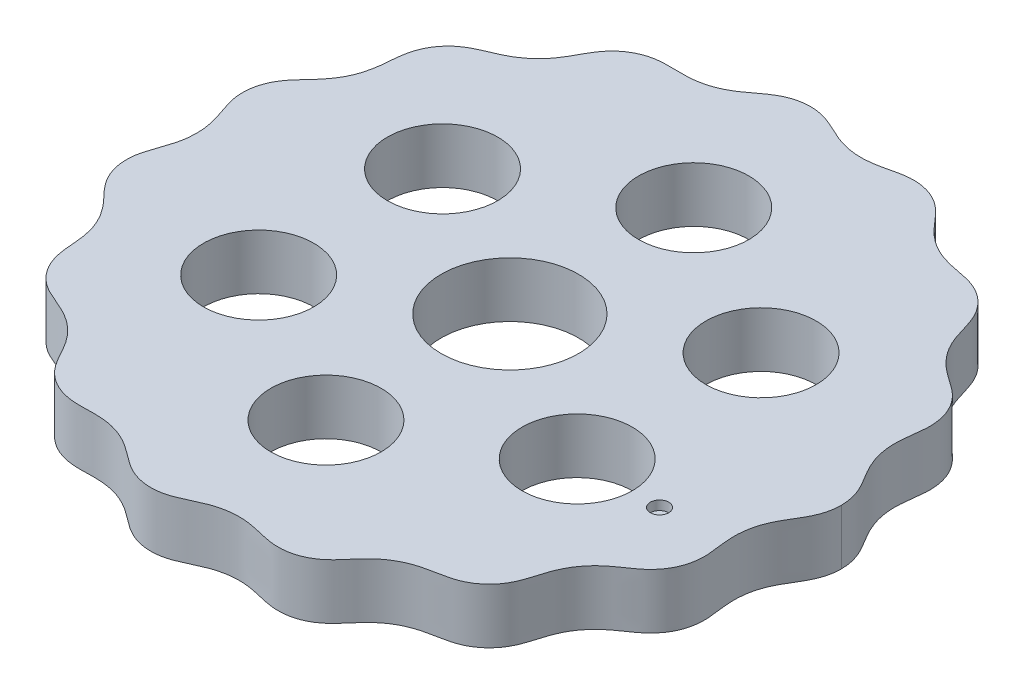
from build123d import *

# Parameters (mm, degrees)
BOSS_EXTRUDE1_DEPTH = 6
SKETCH4_R           = 7.475
SKETCH4_R_2         = 6
CUT_EXTRUDE1_DEPTH  = 52.453967101
SKETCH5_R           = 1
CUT_EXTRUDE2_DEPTH  = 1


with BuildPart() as part:
    # Sketch3 → Boss-Extrude1 (new body)
    with BuildSketch(Plane(origin=(0, 0, 0), x_dir=(1, 0, 0), z_dir=(0, 1, 0))):
        with BuildLine():
            add(Edge.make_bspline(
                [(-35.05, 0), (-35.05, 0.594198712), (-35.191346512, 1.787119828), (-35.774573788, 3.479633265), (-36.370656393, 5.193307382), (-36.439574506, 7.030295887), (-35.925490495, 8.79622364), (-34.876295144, 10.295275654), (-33.585470062, 11.549316205), (-32.487706663, 12.969248766), (-31.742957144, 14.606988848), (-31.396565397, 16.368457148), (-31.326535289, 18.165589032), (-30.95261129, 19.954463161), (-30.017730934, 21.538471981), (-28.632110729, 22.747490259), (-26.968497206, 23.475804895), (-24.757057662, 24.380387794), (-22.911251771, 25.983589547), (-21.734896935, 28.063477736), (-20.879346019, 29.660513957), (-19.589334554, 30.969735845), (-17.95061886, 31.804064637), (-16.138162859, 32.06669982), (-14.340381143, 31.948143856), (-12.549747042, 32.056592443), (-10.825868458, 32.571684344), (-9.270456611, 33.470271575), (-7.887358387, 34.616091716), (-6.327923269, 35.566471435), (-4.533281987, 35.96990507), (-2.70292921, 35.78952335), (-1.035797595, 35.063699847), (0.572152539, 34.273651103), (2.313154203, 33.82213675), (4.112230724, 33.789925988), (5.866279551, 34.152011292), (7.619077132, 34.603765566), (9.455361714, 34.561863227), (11.185634397, 33.938560874), (12.620076924, 32.797434213), (13.740202432, 31.383739916), (15.000377212, 30.10818058), (16.521643713, 29.147509603), (18.222513756, 28.567155407), (19.996356323, 28.29831819), (22.342794246, 27.65042603), (24.201171408, 25.896958922), (25.005623957, 23.605348695), (25.480441092, 21.877479041), (26.284970675, 20.269271474), (27.44342461, 18.892648679), (28.872607627, 17.811880308), (30.387945124, 16.825917609), (31.615542716, 15.461139334), (32.345791834, 13.773450902), (32.497916201, 11.945393512), (32.20498318, 10.163517983), (32.075775497, 8.375827667), (32.351741871, 6.597861172), (33.033589236, 4.934690781), (34.012035472, 3.431229806), (34.855336803, 1.817850793), (35.05, 0.601878761), (35.05, 0)],
                knots=[0.072369566, 0.072369566, 0.072369566, 0.072369566, 0.085664924, 0.098960282, 0.112255641, 0.125550999, 0.138846357, 0.152141715, 0.165437073, 0.178732431, 0.192027789, 0.205323147, 0.218618505, 0.231913863, 0.245209221, 0.25850458, 0.271799938, 0.285095296, 0.311686012, 0.32498137, 0.338276728, 0.351572086, 0.364867444, 0.378162802, 0.39145816, 0.404753519, 0.418048877, 0.431344235, 0.444639593, 0.457934951, 0.471230309, 0.484525667, 0.497821025, 0.511116383, 0.524411741, 0.5377071, 0.551002458, 0.564297816, 0.577593174, 0.590888532, 0.60418389, 0.617479248, 0.630774606, 0.644069964, 0.657365322, 0.67066068, 0.683956039, 0.710546755, 0.723842113, 0.737137471, 0.750432829, 0.763728187, 0.777023545, 0.790318903, 0.803614261, 0.816909619, 0.830204978, 0.843500336, 0.856795694, 0.870091052, 0.88338641, 0.896681768, 0.909977126, 0.923272484, 0.923272484, 0.923272484, 0.923272484], degree=3))
            add(Edge.make_bspline(
                [(35.05, 0), (35.05, -0.601878761), (34.855336803, -1.817850793), (34.012035472, -3.431229806), (33.033589236, -4.934690781), (32.351741871, -6.597861172), (32.075775497, -8.375827667), (32.20498318, -10.163517983), (32.497916201, -11.945393512), (32.345791834, -13.773450902), (31.615542716, -15.461139334), (30.387945124, -16.825917609), (28.872607627, -17.811880308), (27.44342461, -18.892648679), (26.284970675, -20.269271474), (25.480441092, -21.877479041), (25.005623957, -23.605348695), (24.201171408, -25.896958922), (22.342794246, -27.65042603), (19.996356323, -28.29831819), (18.222513756, -28.567155407), (16.521643713, -29.147509603), (15.000377212, -30.10818058), (13.740202432, -31.383739916), (12.620076924, -32.797434213), (11.185634397, -33.938560874), (9.455361714, -34.561863227), (7.619077132, -34.603765566), (5.866279551, -34.152011292), (4.112230724, -33.789925988), (2.313154203, -33.82213675), (0.572152539, -34.273651103), (-1.035797595, -35.063699847), (-2.70292921, -35.78952335), (-4.533281987, -35.96990507), (-6.327923269, -35.566471435), (-7.887358387, -34.616091716), (-9.270456611, -33.470271575), (-10.825868458, -32.571684344), (-12.549747042, -32.056592443), (-14.340381143, -31.948143856), (-16.138162859, -32.06669982), (-17.95061886, -31.804064637), (-19.589334554, -30.969735845), (-20.879346019, -29.660513957), (-21.734896935, -28.063477736), (-22.911251771, -25.983589547), (-24.757057662, -24.380387794), (-26.968497206, -23.475804895), (-28.632110729, -22.747490259), (-30.017730934, -21.538471981), (-30.95261129, -19.954463161), (-31.326535289, -18.165589032), (-31.396565397, -16.368457148), (-31.742957144, -14.606988848), (-32.487706663, -12.969248766), (-33.585470062, -11.549316205), (-34.876295144, -10.295275654), (-35.925490495, -8.79622364), (-36.439574506, -7.030295887), (-36.370656393, -5.193307382), (-35.774573788, -3.479633265), (-35.191346512, -1.787119828), (-35.05, -0.594198712), (-35.05, 0)],
                knots=[0.072369566, 0.072369566, 0.072369566, 0.072369566, 0.085664924, 0.098960282, 0.112255641, 0.125550999, 0.138846357, 0.152141715, 0.165437073, 0.178732431, 0.192027789, 0.205323147, 0.218618505, 0.231913863, 0.245209221, 0.25850458, 0.271799938, 0.285095296, 0.311686012, 0.32498137, 0.338276728, 0.351572086, 0.364867444, 0.378162802, 0.39145816, 0.404753519, 0.418048877, 0.431344235, 0.444639593, 0.457934951, 0.471230309, 0.484525667, 0.497821025, 0.511116383, 0.524411741, 0.5377071, 0.551002458, 0.564297816, 0.577593174, 0.590888532, 0.60418389, 0.617479248, 0.630774606, 0.644069964, 0.657365322, 0.67066068, 0.683956039, 0.710546755, 0.723842113, 0.737137471, 0.750432829, 0.763728187, 0.777023545, 0.790318903, 0.803614261, 0.816909619, 0.830204978, 0.843500336, 0.856795694, 0.870091052, 0.88338641, 0.896681768, 0.909977126, 0.923272484, 0.923272484, 0.923272484, 0.923272484], degree=3))
        make_face()
    extrude(amount=BOSS_EXTRUDE1_DEPTH)

    # Sketch4 → Cut-Extrude1 (cut, through all)
    with BuildSketch(Plane(origin=(0, 6, 0), x_dir=(1, 0, 0), z_dir=(0, 1, 0))):
        with Locations(Location((-1, 0, 0), (0, 0, 270))):
            Circle(SKETCH4_R)
        with Locations(Location((-1, 20, 0), (0, 0, 270))):
            Circle(SKETCH4_R_2)
        with Locations(Location((16.320508076, 10, 0), (0, 0, 270))):
            Circle(SKETCH4_R_2)
        with Locations(Location((16.320508076, -10, 0), (0, 0, 270))):
            Circle(SKETCH4_R_2)
        with Locations(Location((-1, -20, 0), (0, 0, 270))):
            Circle(SKETCH4_R_2)
        with Locations(Location((-18.320508076, -10, 0), (0, 0, 270))):
            Circle(SKETCH4_R_2)
        with Locations(Location((-18.320508076, 10, 0), (0, 0, 270))):
            Circle(SKETCH4_R_2)
    extrude(amount=-CUT_EXTRUDE1_DEPTH, mode=Mode.SUBTRACT)

    # Sketch5 → Cut-Extrude2 (cut)
    with BuildSketch(Plane(origin=(0, 6, 0), x_dir=(1, 0, 0), z_dir=(0, 1, 0))):
        with Locations(Location((25.37148754, -10.092390774, 0), (0, 0, 270))):
            Circle(SKETCH5_R)
    extrude(amount=-CUT_EXTRUDE2_DEPTH, mode=Mode.SUBTRACT)


solid = part.part
